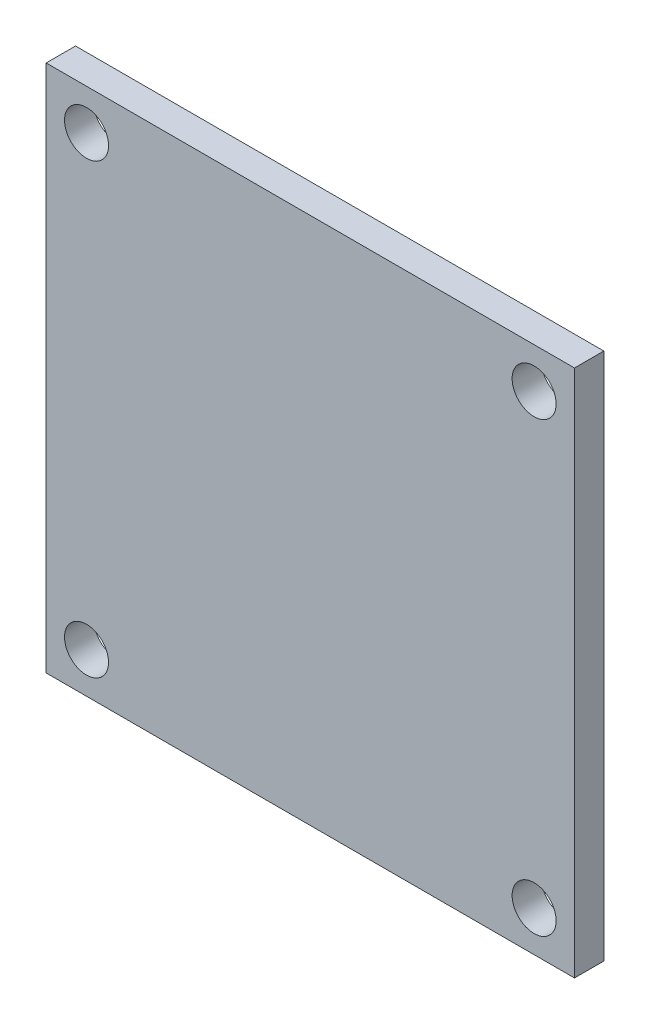
from build123d import *

# Parameters (mm, degrees)
ESQUISSE1_W        = 36
ESQUISSE1_H        = 36
ESQUISSE1_R        = 1.5
BOSS_EXTRU_1_DEPTH = 2


with BuildPart() as part:
    # Esquisse1 → Boss.-Extru.1 (new body)
    with BuildSketch(Plane.XY):
        Rectangle(ESQUISSE1_W, ESQUISSE1_H)
        with Locations((15.25, 15.25)):
            Circle(ESQUISSE1_R, mode=Mode.SUBTRACT)
        with Locations((-15.25, 15.25)):
            Circle(ESQUISSE1_R, mode=Mode.SUBTRACT)
        with Locations((-15.25, -15.25)):
            Circle(ESQUISSE1_R, mode=Mode.SUBTRACT)
        with Locations((15.25, -15.25)):
            Circle(ESQUISSE1_R, mode=Mode.SUBTRACT)
    extrude(amount=BOSS_EXTRU_1_DEPTH)


solid = part.part
